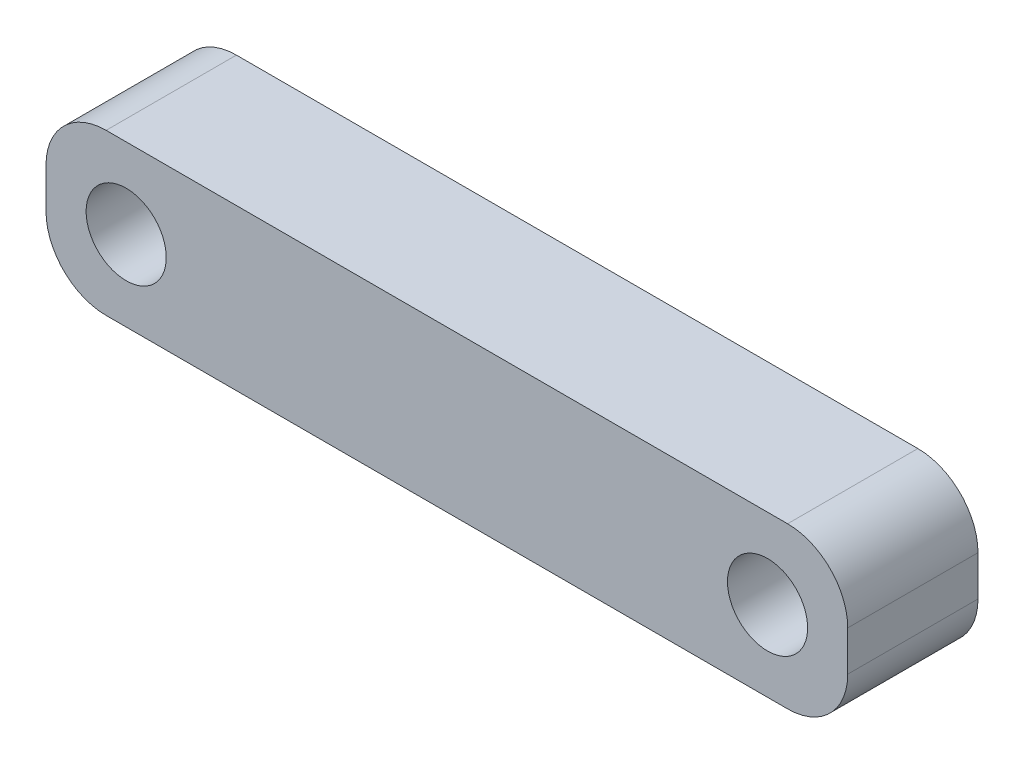
from build123d import *

# Parameters (mm, degrees)
ESQUISSE1_R        = 4
BOSS_EXTRU_1_DEPTH = 13


with BuildPart() as part:
    # Esquisse1 → Boss.-Extru.1 (new body)
    with BuildSketch(Plane.XY):
        with BuildLine():
            Line((-34, -8), (34, -8))
            ThreePointArc((34, -8), (38.242640687, -6.242640687), (40, -2))
            Line((40, -2), (40, 2))
            ThreePointArc((40, 2), (38.242640687, 6.242640687), (34, 8))
            Line((34, 8), (-34, 8))
            ThreePointArc((-34, 8), (-38.242640687, 6.242640687), (-40, 2))
            Line((-40, 2), (-40, -2))
            ThreePointArc((-40, -2), (-38.242640687, -6.242640687), (-34, -8))
        make_face()
        with Locations(Location((-32, 0, 0), (0, 0, 180))):
            Circle(ESQUISSE1_R, mode=Mode.SUBTRACT)
        with Locations(Location((32, 0, 0), (0, 0, 180))):
            Circle(ESQUISSE1_R, mode=Mode.SUBTRACT)
    extrude(amount=BOSS_EXTRU_1_DEPTH)


solid = part.part
